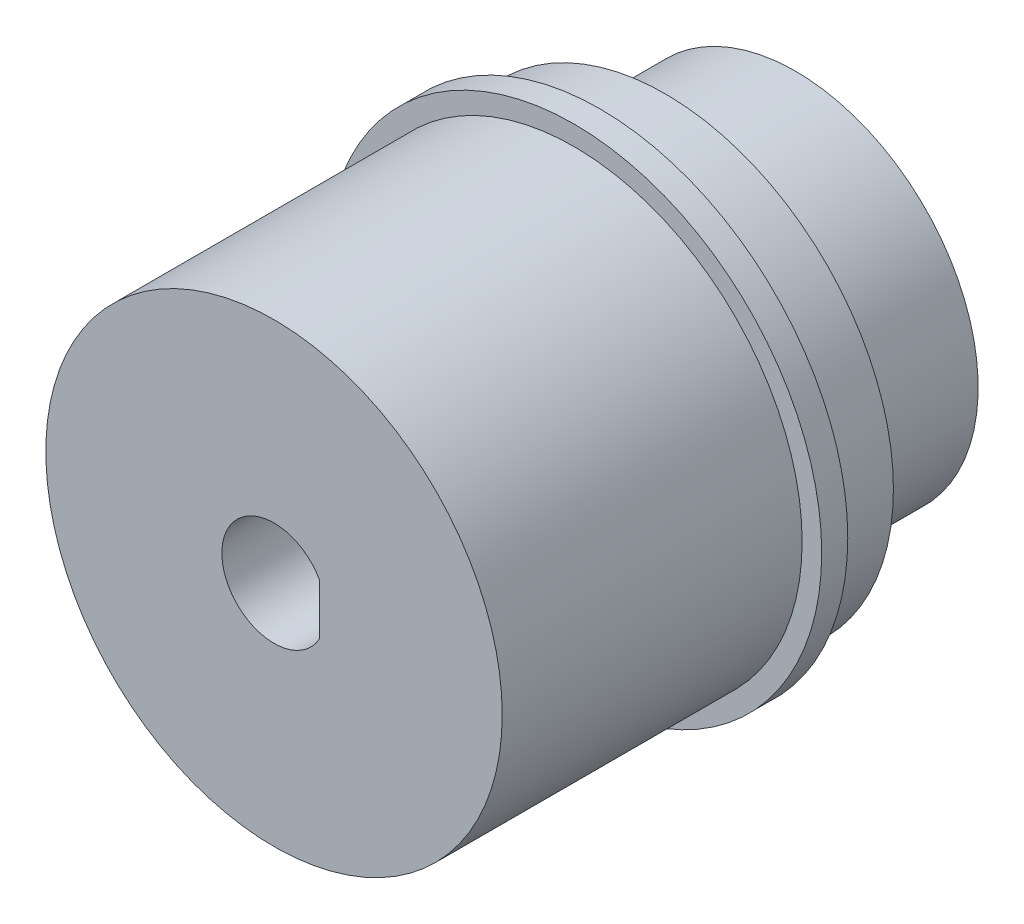
from build123d import *

# Parameters (mm, degrees)
SKETCH1_R           = 14
BOSS_EXTRUDE2_DEPTH = 10
SKETCH2_R           = 17.5
BOSS_EXTRUDE3_DEPTH = 5
SKETCH3_R           = 19
BOSS_EXTRUDE4_DEPTH = 2
SKETCH4_R           = 17.5
BOSS_EXTRUDE5_DEPTH = 23
CUT_EXTRUDE1_DEPTH  = 10
SKETCH10_R          = 2.75
CUT_EXTRUDE2_DEPTH  = 15
CUT_EXTRUDE3_DEPTH  = 15


with BuildPart() as part:
    # Sketch1 → Boss-Extrude2 (new body)
    with BuildSketch(Plane.XY):
        Circle(SKETCH1_R)
    extrude(amount=BOSS_EXTRUDE2_DEPTH)

    # Sketch2 → Boss-Extrude3 (add)
    with BuildSketch(Plane.XY.offset(10)):
        Circle(SKETCH2_R)
    extrude(amount=BOSS_EXTRUDE3_DEPTH)

    # Sketch3 → Boss-Extrude4 (add)
    with BuildSketch(Plane.XY.offset(15)):
        Circle(SKETCH3_R)
    extrude(amount=BOSS_EXTRUDE4_DEPTH)

    # Sketch4 → Boss-Extrude5 (add)
    with BuildSketch(Plane.XY.offset(17)):
        Circle(SKETCH4_R)
    extrude(amount=BOSS_EXTRUDE5_DEPTH)

    # Sketch5 → Cut-Extrude1 (cut)
    with BuildSketch(Plane(origin=(0, 0, 0), x_dir=(-1, 0, 0), z_dir=(0, 0, -1))):
        with BuildLine():
            Line((10, 0), (10, -9.797958971))
            ThreePointArc((10, -9.797958971), (14, 0), (10, 9.797958971))
            Line((10, 9.797958971), (10, 0))
        make_face()
    extrude(amount=-CUT_EXTRUDE1_DEPTH, mode=Mode.SUBTRACT)

    # Sketch10 → Cut-Extrude2 (cut)
    with BuildSketch(Plane(origin=(0, 0, 0), x_dir=(-1, 0, 0), z_dir=(0, 0, -1))):
        Circle(SKETCH10_R)
    extrude(amount=-CUT_EXTRUDE2_DEPTH, mode=Mode.SUBTRACT)

    # Sketch12 → Cut-Extrude3 (cut)
    with BuildSketch(Plane.XY.offset(40)):
        with BuildLine():
            Line((3.5, 0), (3.5, -1.936491673))
            ThreePointArc((3.5, -1.936491673), (-4, 0), (3.5, 1.936491673))
            Line((3.5, 1.936491673), (3.5, 0))
        make_face()
    extrude(amount=-CUT_EXTRUDE3_DEPTH, mode=Mode.SUBTRACT)


solid = part.part
